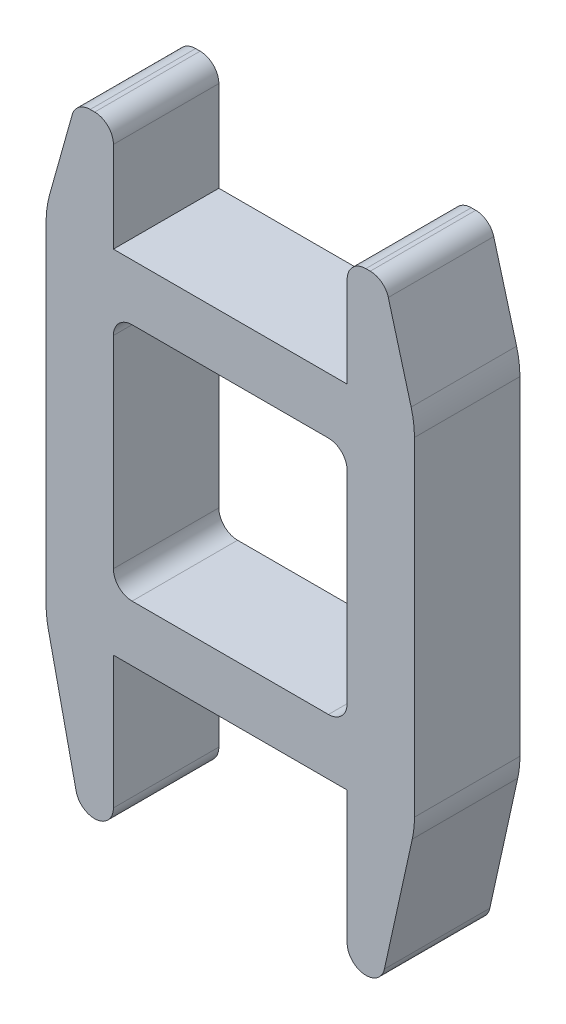
from build123d import *

# Parameters (mm, degrees)
BOSS_EXTRUDE1_DEPTH = 5.64


with BuildPart() as part:
    # Sketch1 → Boss-Extrude1 (new body)
    with BuildSketch(Plane.XY):
        with BuildLine():
            Line((1245.917783232, 971.126361431), (1246.159623553, 971.126361431))
            ThreePointArc((1246.159623553, 971.126361431), (1246.866730334, 970.833468212), (1247.159623553, 970.126361431))
            Line((1247.159623553, 970.126361431), (1247.159623553, 965.277195661))
            Line((1247.159623553, 965.277195661), (1259.659623553, 965.277195661))
            Line((1259.659623553, 965.277195661), (1259.659623553, 970.126361431))
            ThreePointArc((1259.659623553, 970.126361431), (1259.952516772, 970.833468212), (1260.659623553, 971.126361431))
            Line((1260.659623553, 971.126361431), (1260.896428716, 971.126361431))
            ThreePointArc((1260.896428716, 971.126361431), (1261.503120593, 970.921298514), (1261.860992458, 970.390211362))
            Line((1261.860992458, 970.390211362), (1263.082442266, 965.92492236))
            ThreePointArc((1263.082442266, 965.92492236), (1263.215130266, 965.271220008), (1263.259623553, 964.605672702))
            Line((1263.259623553, 964.605672702), (1263.259623553, 947.021688584))
            ThreePointArc((1263.259623553, 947.021688584), (1263.230237407, 946.480395771), (1263.142424389, 945.945465561))
            Line((1263.142424389, 945.945465561), (1261.651855255, 939.182785286))
            ThreePointArc((1261.651855255, 939.182785286), (1261.301695677, 938.618528574), (1260.675295088, 938.398029891))
            Line((1260.675295088, 938.398029891), (1260.659623553, 938.398029891))
            ThreePointArc((1260.659623553, 938.398029891), (1259.952516772, 938.69092311), (1259.659623553, 939.398029891))
            Line((1259.659623553, 939.398029891), (1259.659623553, 946.477195661))
            Line((1259.659623553, 946.477195661), (1247.159623553, 946.477195661))
            Line((1247.159623553, 946.477195661), (1247.159623553, 939.398029891))
            ThreePointArc((1247.159623553, 939.398029891), (1246.866730334, 938.69092311), (1246.159623553, 938.398029891))
            Line((1246.159623553, 938.398029891), (1246.143952018, 938.398029891))
            ThreePointArc((1246.143952018, 938.398029891), (1245.517551429, 938.618528574), (1245.167391851, 939.182785286))
            Line((1245.167391851, 939.182785286), (1243.676822717, 945.945465561))
            ThreePointArc((1243.676822717, 945.945465561), (1243.589009698, 946.480395771), (1243.559623553, 947.021688584))
            Line((1243.559623553, 947.021688584), (1243.559623553, 964.732702737))
            ThreePointArc((1243.559623553, 964.732702737), (1243.606264857, 965.414052599), (1243.745318606, 966.082690842))
            Line((1243.745318606, 966.082690842), (1244.954922243, 970.396359052))
            ThreePointArc((1244.954922243, 970.396359052), (1245.313629949, 970.923229557), (1245.917783232, 971.126361431))
        make_face()
        with BuildLine():
            Line((1247.159623553, 961.277195661), (1247.159623553, 950.477195661))
            ThreePointArc((1247.159623553, 950.477195661), (1247.452516772, 949.77008888), (1248.159623553, 949.477195661))
            Line((1248.159623553, 949.477195661), (1258.659623553, 949.477195661))
            ThreePointArc((1258.659623553, 949.477195661), (1259.366730334, 949.77008888), (1259.659623553, 950.477195661))
            Line((1259.659623553, 950.477195661), (1259.659623553, 961.277195661))
            ThreePointArc((1259.659623553, 961.277195661), (1259.366730334, 961.984302442), (1258.659623553, 962.277195661))
            Line((1258.659623553, 962.277195661), (1248.159623553, 962.277195661))
            ThreePointArc((1248.159623553, 962.277195661), (1247.452516772, 961.984302442), (1247.159623553, 961.277195661))
        make_face(mode=Mode.SUBTRACT)
    extrude(amount=BOSS_EXTRUDE1_DEPTH)


solid = part.part
